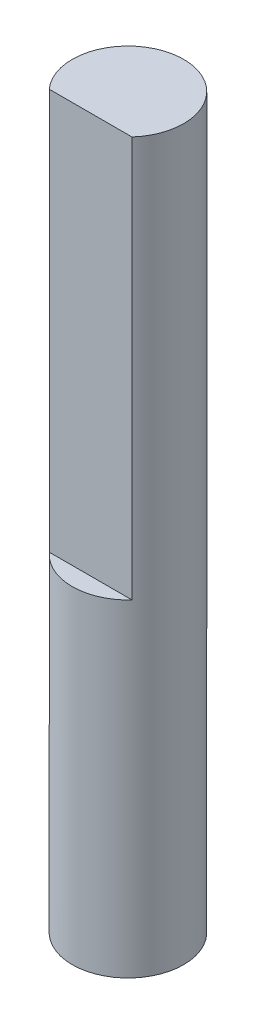
from build123d import *

# Parameters (mm, degrees)
SKETCH1_R           = 2.5019
BOSS_EXTRUDE1_DEPTH = 14.7
BOSS_EXTRUDE2_DEPTH = 18


with BuildPart() as part:
    # Sketch1 → Boss-Extrude1 (new body)
    with BuildSketch(Plane(origin=(0, 0, 0), x_dir=(1, 0, 0), z_dir=(0, 1, 0))):
        with Locations(Location((0, 0, 0), (0, 0, 270))):
            Circle(SKETCH1_R)
    extrude(amount=BOSS_EXTRUDE1_DEPTH)

    # Sketch2 → Boss-Extrude2 (add)
    with BuildSketch(Plane(origin=(0, 14.7, 0), x_dir=(1, 0, 0), z_dir=(0, 1, 0))):
        with BuildLine():
            Line((-1.855488361, -1.678292749), (1.855488361, -1.678292749))
            ThreePointArc((1.855488361, -1.678292749), (0, 2.5019), (-1.855488361, -1.678292749))
        make_face()
    extrude(amount=BOSS_EXTRUDE2_DEPTH)


solid = part.part
